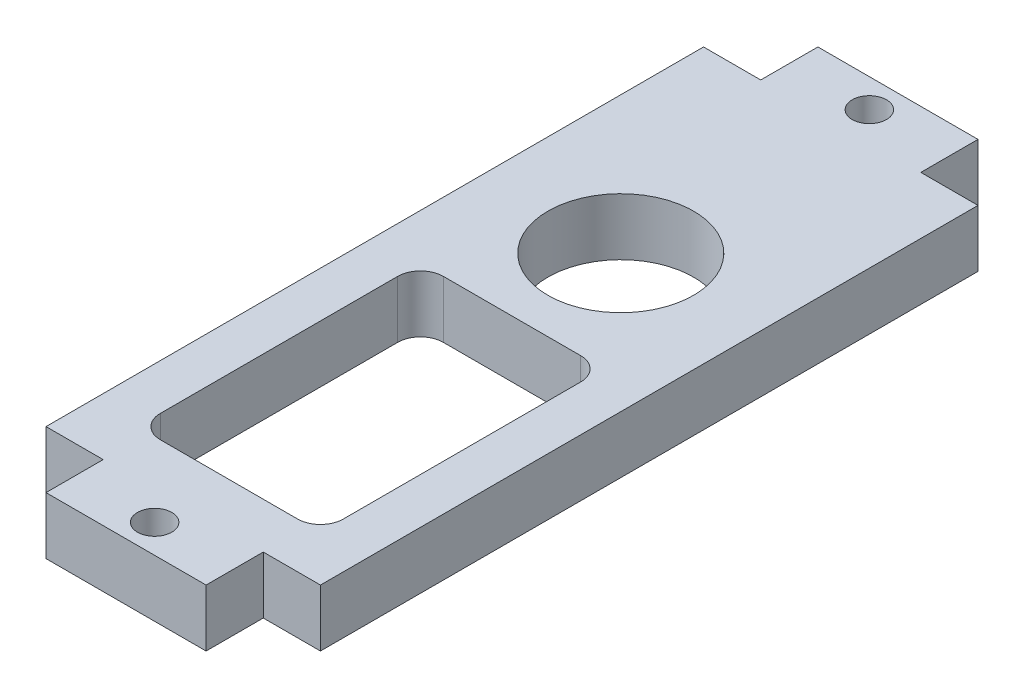
from build123d import *

# Parameters (mm, degrees)
SKETCH1_R           = 1.5
BOSS_EXTRUDE1_DEPTH = 5
SKETCH2_R           = 6.375
CUT_EXTRUDE1_DEPTH  = 10
SKETCH3_W           = 16
SKETCH3_H           = 24.75
CUT_EXTRUDE2_DEPTH  = 10
FILLET1_R           = 2


with BuildPart() as part:
    # Sketch1 → Boss-Extrude1 (new body)
    with BuildSketch(Plane(origin=(0, 0, 0), x_dir=(1, 0, 0), z_dir=(0, 1, 0))):
        Polygon((5, -14), (19, -14), (19, -9), (24, -9), (24, 48.5), (19, 48.5), (19, 53.5), (5, 53.5), (5, 48.5), (0, 48.5), (0, -9), (5, -9), align=None)
        with Locations(Location((12, 51, 0), (0, 0, 270))):
            Circle(SKETCH1_R, mode=Mode.SUBTRACT)
        with Locations(Location((12, -11.5, 0), (0, 0, 90))):
            Circle(SKETCH1_R, mode=Mode.SUBTRACT)
    extrude(amount=BOSS_EXTRUDE1_DEPTH)

    # Sketch2 → Cut-Extrude1 (cut)
    with BuildSketch(Plane(origin=(0, 5, 0), x_dir=(1, 0, 0), z_dir=(0, 1, 0))):
        with Locations(Location((12, 29.26, 0), (0, 0, 270))):
            Circle(SKETCH2_R)
    extrude(amount=-CUT_EXTRUDE1_DEPTH, mode=Mode.SUBTRACT)

    # Sketch3 → Cut-Extrude2 (cut)
    with BuildSketch(Plane(origin=(0, 5, 0), x_dir=(1, 0, 0), z_dir=(0, 1, 0))):
        with Locations((12, 7.375)):
            Rectangle(SKETCH3_W, SKETCH3_H)
    extrude(amount=-CUT_EXTRUDE2_DEPTH, mode=Mode.SUBTRACT)

    # Fillet1
    fillet1_edges = [part.edges().sort_by_distance(p)[0] for p in [
        (20, 2.5, 5),
        (4, 2.5, 5),
        (4, 2.5, -19.75),
        (20, 2.5, -19.75),
    ]]
    fillet(fillet1_edges, radius=FILLET1_R)


solid = part.part
